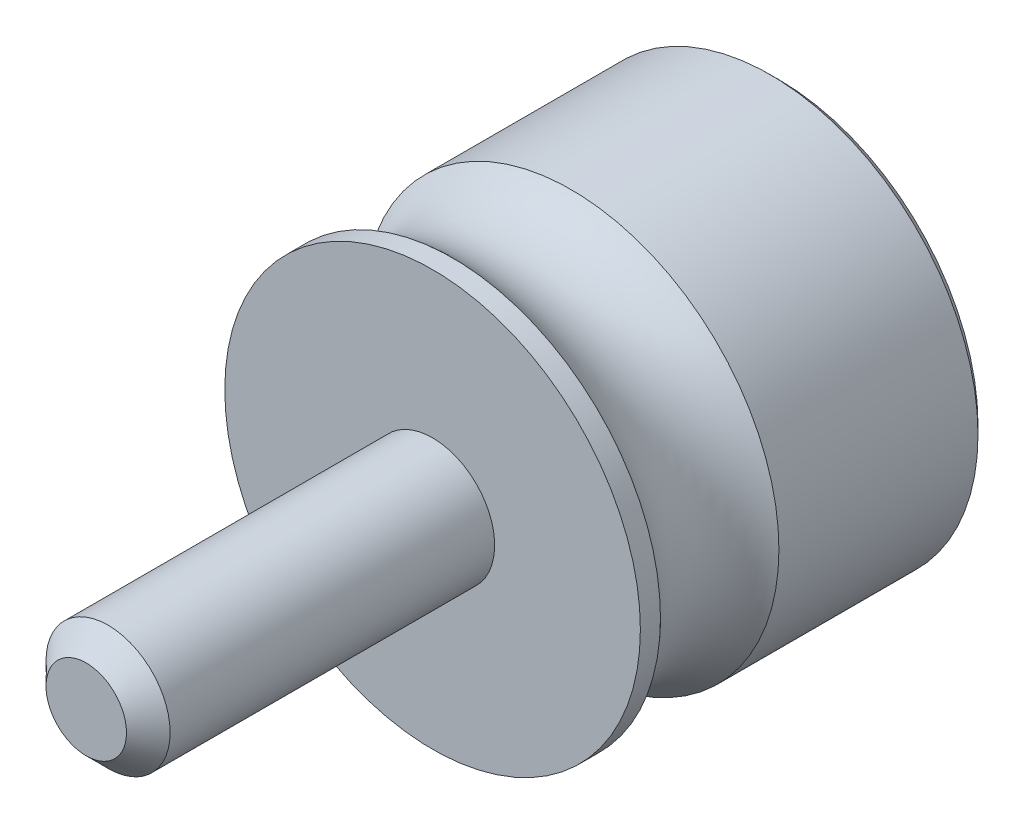
from build123d import *

# Parameters (mm, degrees)
SKETCH1_R           = 4.7625
BOSS_EXTRUDE1_DEPTH = 4.7625
SKETCH3_R           = 1.4224
BOSS_EXTRUDE2_DEPTH = 7.9375
CHAMFER1_SIZE       = 0.2
CHAMFER2_SIZE       = 0.5


with BuildPart() as part:
    # Sketch1 → Boss-Extrude1 (new body)
    with BuildSketch(Plane.XY):
        with Locations(Location((0, 0, 0), (0, 0, 180))):
            Circle(SKETCH1_R)
    extrude(amount=BOSS_EXTRUDE1_DEPTH)

    # Sketch2 → Revolve1 (revolve)
    with BuildSketch(Plane(origin=(0, 0, 0), x_dir=(1, 0, 0), z_dir=(0, 1, 0)), mode=Mode.PRIVATE) as revolve1_sk:
        with BuildLine():
            Line((-4.7625, -7.477150663), (-4.7625, -7.9375))
            Line((-4.7625, -7.9375), (0, -7.9375))
            Line((0, -7.9375), (0, -4.7625))
            Line((0, -4.7625), (-4.7625, -4.7625))
            ThreePointArc((-4.7625, -4.7625), (-4.200277439, -6.119825331), (-4.7625, -7.477150663))
        make_face()
    revolve(revolve1_sk.sketch.rotate(Axis((0, 0, 7.9375), (0, 0, -1)), 180), axis=Axis((0, 0, 7.9375), (0, 0, -1)))

    # Sketch3 → Boss-Extrude2 (add)
    with BuildSketch(Plane.XY.offset(7.9375)):
        with Locations(Location((0, 0, 0), (0, 0, 180))):
            Circle(SKETCH3_R)
    extrude(amount=BOSS_EXTRUDE2_DEPTH)

    # Chamfer1
    chamfer1_edges = [part.edges().sort_by_distance(p)[0] for p in [
        (4.7625, 0, 0),
    ]]
    chamfer(chamfer1_edges, length=CHAMFER1_SIZE)

    # Chamfer2
    chamfer2_edges = [part.edges().sort_by_distance(p)[0] for p in [
        (1.4224, 0, 15.875),
    ]]
    chamfer(chamfer2_edges, length=CHAMFER2_SIZE)


solid = part.part
